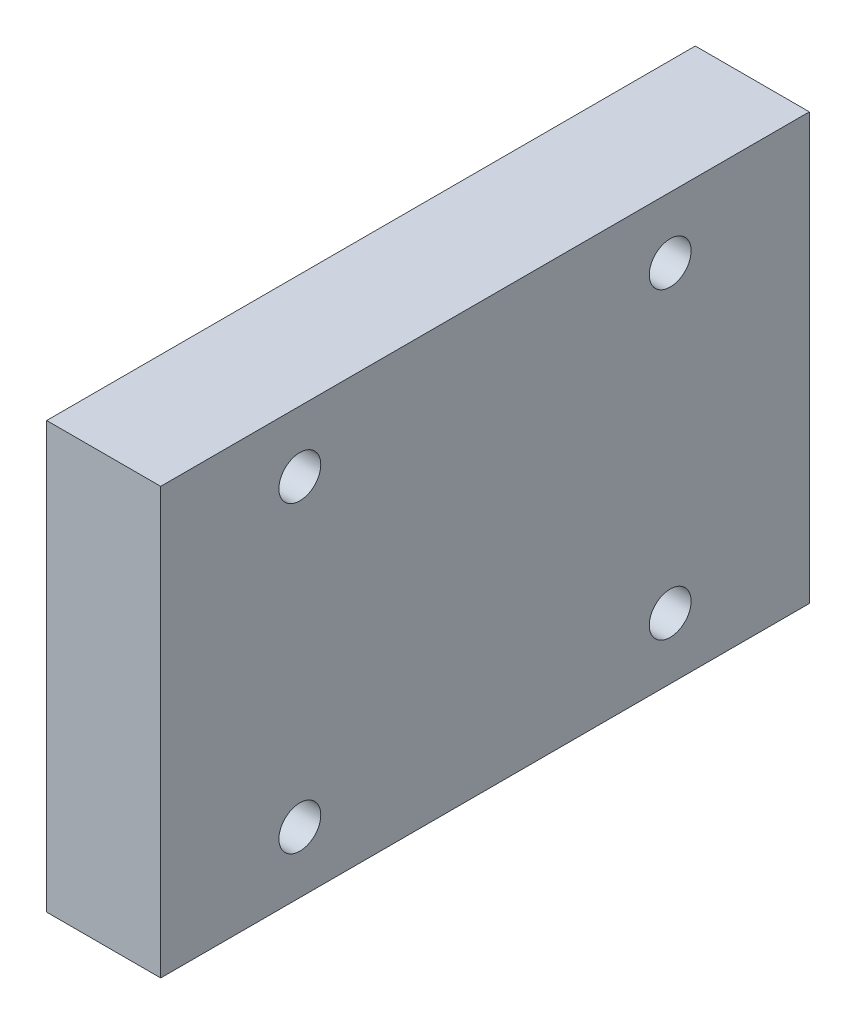
from build123d import *

# Parameters (mm, degrees)
SKETCH1_W           = 31
SKETCH1_H           = 20.35
SKETCH1_R           = 1
BOSS_EXTRUDE1_DEPTH = 5.45


with BuildPart() as part:
    # Sketch1 → Boss-Extrude1 (new body)
    with BuildSketch(Plane(origin=(0, 0, 0), x_dir=(0, 0, -1), z_dir=(1, 0, 0))):
        with Locations((15.5, 10.175)):
            Rectangle(SKETCH1_W, SKETCH1_H)
        with Locations((6.65, 2.925)):
            Circle(SKETCH1_R, mode=Mode.SUBTRACT)
        with Locations((6.65, 17.425)):
            Circle(SKETCH1_R, mode=Mode.SUBTRACT)
        with Locations((24.35, 17.425)):
            Circle(SKETCH1_R, mode=Mode.SUBTRACT)
        with Locations((24.35, 2.925)):
            Circle(SKETCH1_R, mode=Mode.SUBTRACT)
    extrude(amount=BOSS_EXTRUDE1_DEPTH)


solid = part.part
